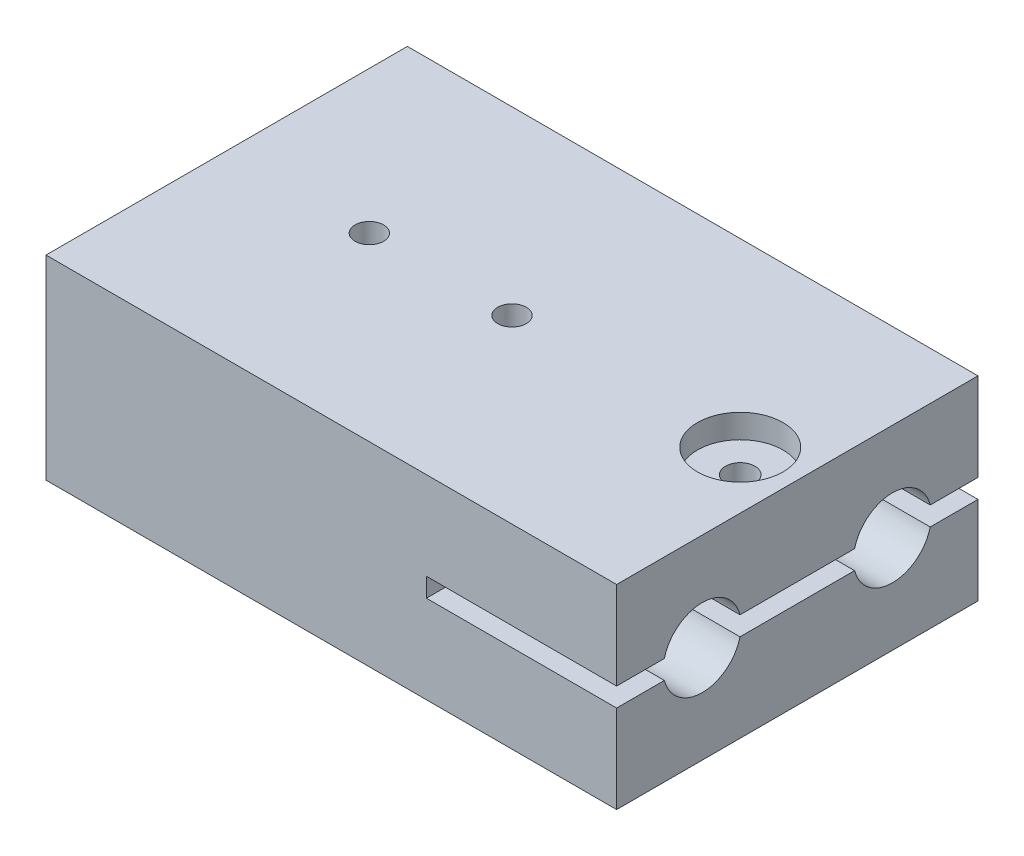
from build123d import *

# Parameters (mm, degrees)
CROQUIS3_W              = 38
CROQUIS3_H              = 21.5
SALIENTE_EXTRUIR2_DEPTH = 60
CROQUIS4_R              = 4.1
CORTAR_EXTRUIR2_DEPTH   = 60
CROQUIS5_W              = 20
CROQUIS5_H              = 2
CORTAR_EXTRUIR4_DEPTH   = 39
CROQUIS6_R              = 3.5
CORTAR_EXTRUIR5_DEPTH   = 3
CROQUIS7_R              = 1.55
CORTAR_EXTRUIR6_DEPTH   = 22
CROQUIS8_R              = 4.5
CORTAR_EXTRUIR7_DEPTH   = 3
CROQUIS9_R              = 1.5
CORTAR_EXTRUIR8_DEPTH   = 15
CROQUIS10_W             = 38
CROQUIS10_H             = 0.5
CORTAR_EXTRUIR9_DEPTH   = 60


with BuildPart() as part:
    # Croquis3 → Saliente-Extruir2 (new body)
    with BuildSketch(Plane(origin=(0, 0, 0), x_dir=(0, 0, -1), z_dir=(1, 0, 0))):
        Rectangle(CROQUIS3_W, CROQUIS3_H)
    extrude(amount=SALIENTE_EXTRUIR2_DEPTH)

    # Croquis4 → Cortar-Extruir2 (cut)
    with BuildSketch(Plane(origin=(60, 0, 0), x_dir=(0, 0, -1), z_dir=(1, 0, 0))):
        with Locations((-10, 0)):
            Circle(CROQUIS4_R)
        with Locations((10, 0)):
            Circle(CROQUIS4_R)
    extrude(amount=-CORTAR_EXTRUIR2_DEPTH, mode=Mode.SUBTRACT)

    # Croquis5 → Cortar-Extruir4 (cut)
    with BuildSketch(Plane.XY.offset(19)):
        with Locations((50, 0)):
            Rectangle(CROQUIS5_W, CROQUIS5_H)
    extrude(amount=-CORTAR_EXTRUIR4_DEPTH, mode=Mode.SUBTRACT)

    # Croquis6 → Cortar-Extruir5 (cut)
    with BuildSketch(Plane.XZ.offset(10.75)):
        with Locations(Location((54, 0, 0), (0, 0, 270))):
            Circle(CROQUIS6_R)
    extrude(amount=-CORTAR_EXTRUIR5_DEPTH, mode=Mode.SUBTRACT)

    # Croquis7 → Cortar-Extruir6 (cut)
    with BuildSketch(Plane.XZ.offset(10.75)):
        with Locations(Location((54, 0, 0), (0, 0, 270))):
            Circle(CROQUIS7_R)
    extrude(amount=-CORTAR_EXTRUIR6_DEPTH, mode=Mode.SUBTRACT)

    # Croquis8 → Cortar-Extruir7 (cut)
    with BuildSketch(Plane(origin=(0, 10.75, 0), x_dir=(1, 0, 0), z_dir=(0, 1, 0))):
        with Locations(Location((54, 0, 0), (0, 0, 270))):
            Circle(CROQUIS8_R)
    extrude(amount=-CORTAR_EXTRUIR7_DEPTH, mode=Mode.SUBTRACT)

    # Croquis9 → Cortar-Extruir8 (cut)
    with BuildSketch(Plane(origin=(0, 10.75, 0), x_dir=(1, 0, 0), z_dir=(0, 1, 0))):
        with Locations(Location((30, 0, 0), (0, 0, 270))):
            Circle(CROQUIS9_R)
        with Locations(Location((15, 0, 0), (0, 0, 270))):
            Circle(CROQUIS9_R)
    extrude(amount=-CORTAR_EXTRUIR8_DEPTH, mode=Mode.SUBTRACT)

    # Croquis10 → Cortar-Extruir9 (cut)
    with BuildSketch(Plane.ZY):
        with Locations((0, 10.5)):
            Rectangle(CROQUIS10_W, CROQUIS10_H)
        with Locations((0, -10.5)):
            Rectangle(CROQUIS10_W, CROQUIS10_H)
    extrude(amount=-CORTAR_EXTRUIR9_DEPTH, mode=Mode.SUBTRACT)


solid = part.part
